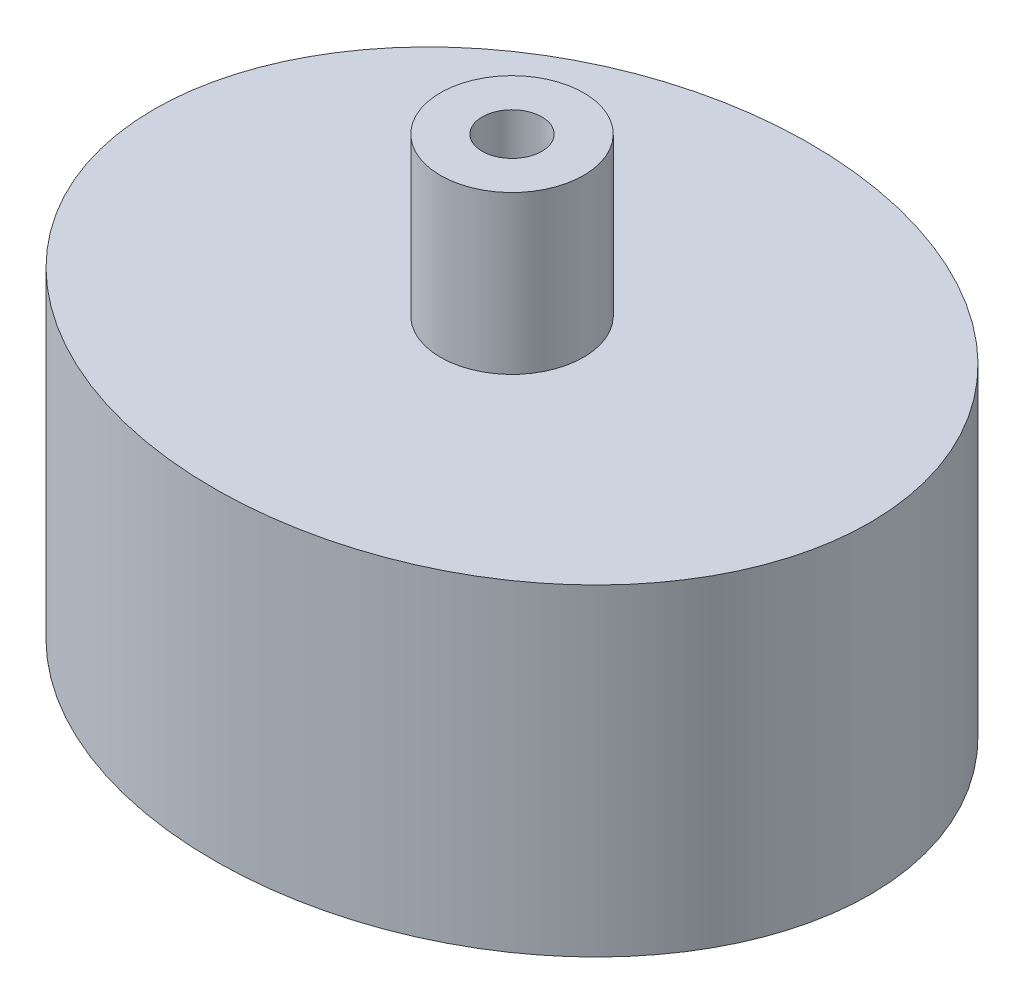
from build123d import *

# Parameters (mm, degrees)
SKETCH1_R               = 25.4
BOSS_EXTRUDE1_DEPTH     = 5.842
SKETCH2_RX              = 76.2
SKETCH2_RY              = 63.5
BOSS_EXTRUDE2_DEPTH     = 68.58
SKETCH3_R               = 15.24
BOSS_EXTRUDE3_DEPTH     = 33.528
CUT_EXTRUDE2_DEPTH      = 147.601134034
CUT_EXTRUDE2_DEPTH_BACK = 147.601134034
SKETCH4_R               = 6.35


with BuildPart() as part:
    # Sketch1 → Boss-Extrude1 (new body)
    with BuildSketch(Plane(origin=(0, 0, 0), x_dir=(1, 0, 0), z_dir=(0, 1, 0))):
        with Locations(Location((0, 0, 0), (0, 0, 270))):
            Circle(SKETCH1_R)
    extrude(amount=BOSS_EXTRUDE1_DEPTH)

    # Sketch2 → Boss-Extrude2 (add)
    with BuildSketch(Plane(origin=(0, 5.842, 0), x_dir=(1, 0, 0), z_dir=(0, 1, 0))):
        with Locations(Location((0, 0), (0, 0, 180))):
            Ellipse(SKETCH2_RX, SKETCH2_RY)
    extrude(amount=BOSS_EXTRUDE2_DEPTH)

    # Sketch3 → Boss-Extrude3 (add)
    with BuildSketch(Plane(origin=(0, 74.422, 0), x_dir=(1, 0, 0), z_dir=(0, 1, 0))):
        with Locations(Location((0, 0, 0), (0, 0, 270))):
            Circle(SKETCH3_R)
    extrude(amount=BOSS_EXTRUDE3_DEPTH)

    # Sketch4 → Cut-Extrude2 (cut, two sides: drawn at the far end of the back side and taken through both)
    with BuildSketch(Plane(origin=(0, 0, 0), x_dir=(1, 0, 0), z_dir=(0, 1, 0)).offset(-CUT_EXTRUDE2_DEPTH_BACK)):
        with Locations(Location((0, 0, 0), (0, 0, 270))):
            Circle(SKETCH4_R)
    extrude(amount=CUT_EXTRUDE2_DEPTH + CUT_EXTRUDE2_DEPTH_BACK, mode=Mode.SUBTRACT)


solid = part.part
